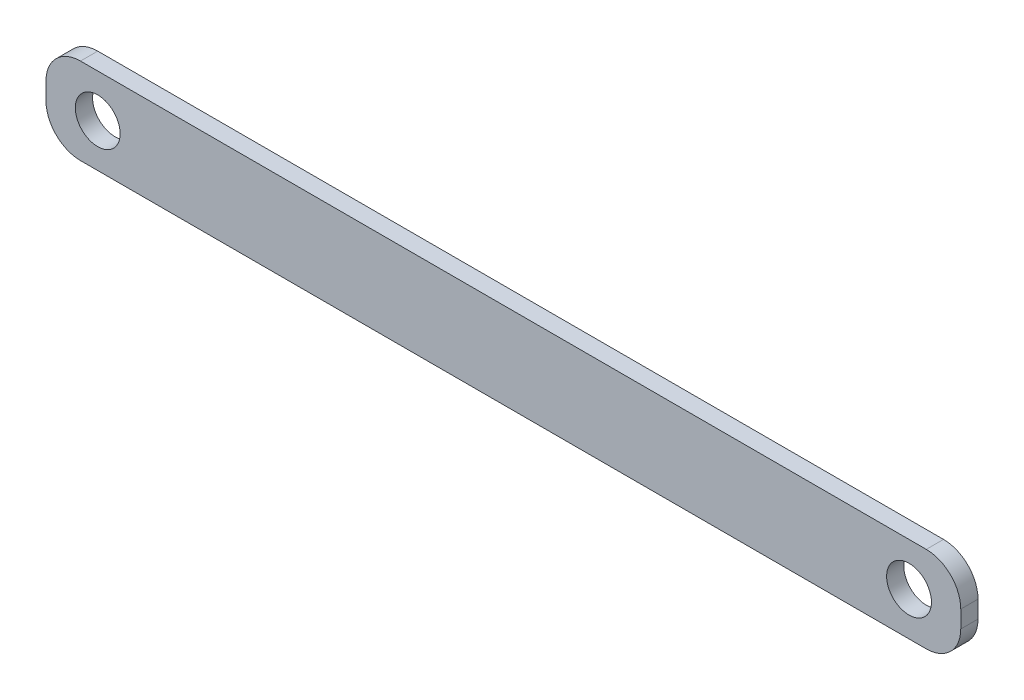
from build123d import *

# Parameters (mm, degrees)
SKETCH1_R           = 6.5
BOSS_EXTRUDE1_DEPTH = 2.5


with BuildPart() as part:
    # Sketch1 → Boss-Extrude1 (new, symmetric)
    with BuildSketch(Plane.XY):
        with BuildLine():
            Line((-125.22896295, 12.5), (120, 12.5))
            ThreePointArc((120, 12.5), (127.071067812, 9.571067812), (130, 2.5))
            Line((130, 2.5), (130, -2.5))
            ThreePointArc((130, -2.5), (127.071067812, -9.571067812), (120, -12.5))
            Line((120, -12.5), (-125.22896295, -12.5))
            ThreePointArc((-125.22896295, -12.5), (-132.300030762, -9.571067812), (-135.22896295, -2.5))
            Line((-135.22896295, -2.5), (-135.22896295, 2.5))
            ThreePointArc((-135.22896295, 2.5), (-132.300030762, 9.571067812), (-125.22896295, 12.5))
        make_face()
        with Locations((-120.22896295, 0)):
            Circle(SKETCH1_R, mode=Mode.SUBTRACT)
        with Locations((115, 0)):
            Circle(SKETCH1_R, mode=Mode.SUBTRACT)
    extrude(amount=BOSS_EXTRUDE1_DEPTH, both=True)


solid = part.part
